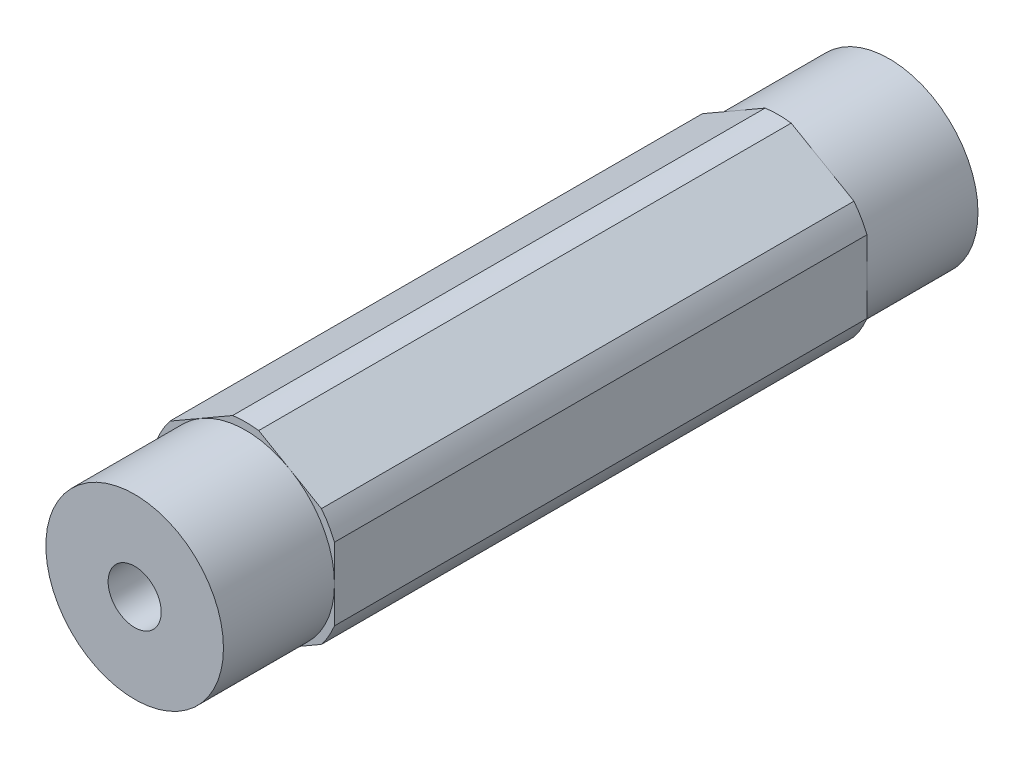
from build123d import *

# Parameters (mm, degrees)
BOSS_EXTRUDE1_DEPTH                  = 26.9748
CUT_EXTRUDE_THIN1_DEPTH              = 29.548108502
CUT_EXTRUDE_THIN1_DEPTH_BACK         = 7.9375
CUT_EXTRUDE_THIN1_START              = 26.9748
SKETCH2_R                            = 8.89
SKETCH2_R_2                          = 6.35
CUT_EXTRUDE_THIN2_START              = -26.9748
SKETCH2_2_R                          = 8.89
SKETCH2_2_R_2                        = 6.35
CUT_EXTRUDE_THIN2_DEPTH              = 7.9375
F_10_24_TAPPED_HOLE1_D               = 3.7973
F_10_24_TAPPED_HOLE1_DEPTH           = 11.938
F_10_24_TAPPED_HOLE1_TIP             = 1.140824014
F_10_24_TAPPED_HOLE1_ON_FACE_2_D     = 3.7973
F_10_24_TAPPED_HOLE1_ON_FACE_2_DEPTH = 11.938
F_10_24_TAPPED_HOLE1_ON_FACE_2_TIP   = 1.140824014


with BuildPart() as part:
    # Sketch1 → Boss-Extrude1 (new, symmetric)
    with BuildSketch(Plane.XY):
        with BuildLine():
            ThreePointArc((0.93173274, 6.79441227), (0, 6.858), (-0.93173274, 6.79441227))
            Line((-0.93173274, 6.79441227), (-5.41826726, 4.204110358))
            ThreePointArc((-5.41826726, 4.204110358), (-5.939202219, 3.429), (-6.35, 2.590301913))
            Line((-6.35, 2.590301913), (-6.35, -2.590301913))
            ThreePointArc((-6.35, -2.590301913), (-5.939202219, -3.429), (-5.41826726, -4.204110358))
            Line((-5.41826726, -4.204110358), (-0.93173274, -6.79441227))
            ThreePointArc((-0.93173274, -6.79441227), (0, -6.858), (0.93173274, -6.79441227))
            Line((0.93173274, -6.79441227), (5.41826726, -4.204110358))
            ThreePointArc((5.41826726, -4.204110358), (5.939202219, -3.429), (6.35, -2.590301913))
            Line((6.35, -2.590301913), (6.35, 2.590301913))
            ThreePointArc((6.35, 2.590301913), (5.939202219, 3.429), (5.41826726, 4.204110358))
            Line((5.41826726, 4.204110358), (0.93173274, 6.79441227))
        make_face()
    extrude(amount=BOSS_EXTRUDE1_DEPTH, both=True)

    # Sketch2 → Cut-Extrude-Thin1 (cut, two sides: drawn at the far end of the back side and taken through both)
    with BuildSketch(Plane.XY.offset(CUT_EXTRUDE_THIN1_START - CUT_EXTRUDE_THIN1_DEPTH_BACK)):
        Circle(SKETCH2_R)
        Circle(SKETCH2_R_2, mode=Mode.SUBTRACT)
    extrude(amount=CUT_EXTRUDE_THIN1_DEPTH + CUT_EXTRUDE_THIN1_DEPTH_BACK, mode=Mode.SUBTRACT)

    # Sketch2<2> → Cut-Extrude-Thin2 (cut)
    with BuildSketch(Plane.XY.offset(CUT_EXTRUDE_THIN2_START)):
        Circle(SKETCH2_2_R)
        Circle(SKETCH2_2_R_2, mode=Mode.SUBTRACT)
    extrude(amount=CUT_EXTRUDE_THIN2_DEPTH, mode=Mode.SUBTRACT)

    # #10-24 Tapped Hole1
    with Locations(Plane.XY.offset(26.9748)):
        with Locations((0, 0)):
            Hole(F_10_24_TAPPED_HOLE1_D / 2, depth=F_10_24_TAPPED_HOLE1_DEPTH)
            with Locations((0, 0, -(F_10_24_TAPPED_HOLE1_DEPTH + F_10_24_TAPPED_HOLE1_TIP / 2))):  # 118° drill point
                Cone(0, F_10_24_TAPPED_HOLE1_D / 2, F_10_24_TAPPED_HOLE1_TIP, mode=Mode.SUBTRACT)

    # #10-24 Tapped Hole1 on face 2
    with Locations(Plane(origin=(0, 0, -26.9748), x_dir=(-1, 0, 0), z_dir=(0, 0, -1))):
        with Locations((0, 0)):
            Hole(F_10_24_TAPPED_HOLE1_ON_FACE_2_D / 2, depth=F_10_24_TAPPED_HOLE1_ON_FACE_2_DEPTH)
            with Locations((0, 0, -(F_10_24_TAPPED_HOLE1_ON_FACE_2_DEPTH + F_10_24_TAPPED_HOLE1_ON_FACE_2_TIP / 2))):  # 118° drill point
                Cone(0, F_10_24_TAPPED_HOLE1_ON_FACE_2_D / 2, F_10_24_TAPPED_HOLE1_ON_FACE_2_TIP, mode=Mode.SUBTRACT)


solid = part.part
